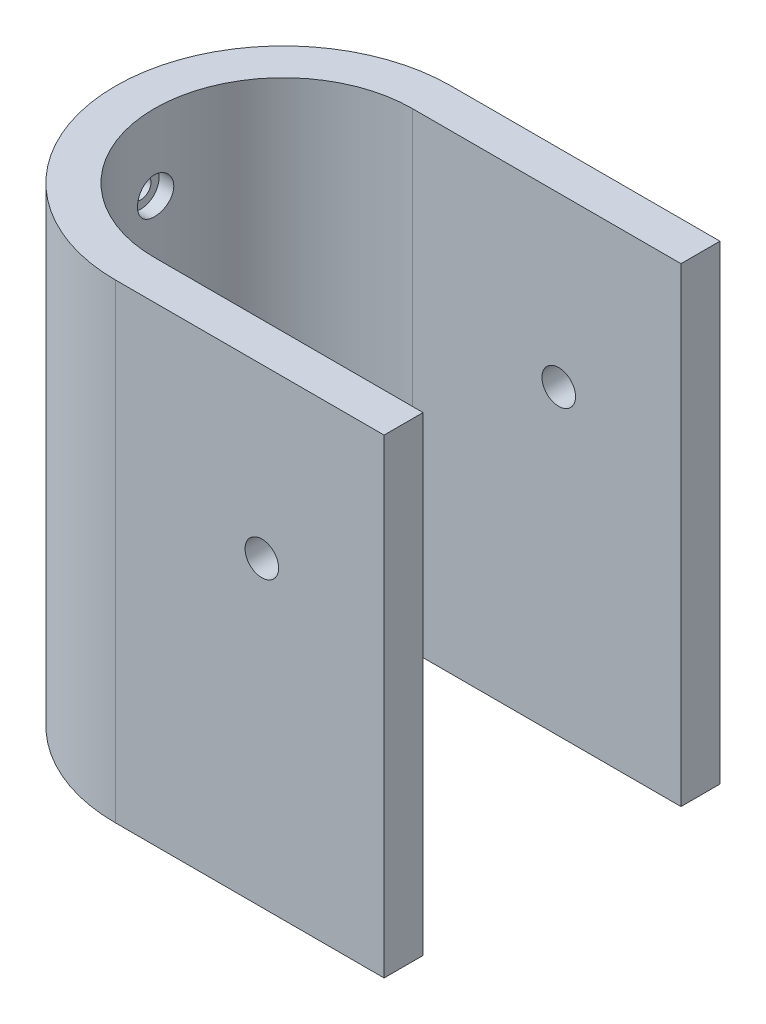
from build123d import *

# Parameters (mm, degrees)
EXTRUDE_1_DEPTH          = 70
CUT_EXTRUDE_1_DEPTH      = 3
CUT_EXTRUDE_1_DEPTH_BACK = 79.421935707
SKETCH_2_R               = 1.5
SKETCH_6_R               = 2.7
SKETCH_6_R_2             = 1.5
CUT_EXTRUDE_3_DEPTH      = 21.2
SKETCH_7_W               = 40
SKETCH_7_H               = 5.8
EXTRUDE_2_DEPTH          = 70
CUT_EXTRUDE_4_REACH      = 96.868
SKETCH_8_R               = 2.5


with BuildPart() as part:
    # 草图1 → 凸台-拉伸1 (new body)
    with BuildSketch(Plane(origin=(0, 0, 0), x_dir=(1, 0, 0), z_dir=(0, 1, 0))):
        with BuildLine():
            Line((0, 25), (0, 19.2))
            ThreePointArc((0, 19.2), (-19.2, 0), (0, -19.2))
            Line((0, -19.2), (0, -25))
            ThreePointArc((0, -25), (-25, 0), (0, 25))
        make_face()
    extrude(amount=EXTRUDE_1_DEPTH)

    # 草图2 → 切除-拉伸1 (cut, two sides: drawn at the far end of the back side and taken through both)
    with BuildSketch(Plane(origin=(0, 0, 0), x_dir=(0, 0, -1), z_dir=(1, 0, 0)).offset(-CUT_EXTRUDE_1_DEPTH_BACK)):
        with Locations(Location((0, 58.75, 0), (0, 0, 180))):
            Circle(SKETCH_2_R)
        with Locations(Location((0, 44.75, 0), (0, 0, 180))):
            Circle(SKETCH_2_R)
        with Locations(Location((0, 24, 0), (0, 0, 180))):
            Circle(SKETCH_2_R)
        with Locations(Location((0, 10, 0), (0, 0, 180))):
            Circle(SKETCH_2_R)
    extrude(amount=CUT_EXTRUDE_1_DEPTH + CUT_EXTRUDE_1_DEPTH_BACK, mode=Mode.SUBTRACT)

    # 草图6 → 切除-拉伸3 (cut)
    # profile 1 of 4: a face of its own
    with BuildSketch(Plane(origin=(0, 0, 0), x_dir=(0, 0, -1), z_dir=(1, 0, 0))):
        with Locations((0, 58.75)):
            Circle(SKETCH_6_R)
        with Locations(Location((0, 58.75, 0), (0, 0, 180))):
            Circle(SKETCH_6_R_2, mode=Mode.SUBTRACT)
    # profile 2 of 4: a face of its own
    with BuildSketch(Plane(origin=(0, 0, 0), x_dir=(0, 0, -1), z_dir=(1, 0, 0))):
        with Locations((0, 44.75)):
            Circle(SKETCH_6_R)
        with Locations(Location((0, 44.75, 0), (0, 0, 180))):
            Circle(SKETCH_6_R_2, mode=Mode.SUBTRACT)
    # profile 3 of 4: a face of its own
    with BuildSketch(Plane(origin=(0, 0, 0), x_dir=(0, 0, -1), z_dir=(1, 0, 0))):
        with Locations((0, 24)):
            Circle(SKETCH_6_R)
        with Locations(Location((0, 24, 0), (0, 0, 180))):
            Circle(SKETCH_6_R_2, mode=Mode.SUBTRACT)
    # profile 4 of 4: a face of its own
    with BuildSketch(Plane(origin=(0, 0, 0), x_dir=(0, 0, -1), z_dir=(1, 0, 0))):
        with Locations((0, 10)):
            Circle(SKETCH_6_R)
        with Locations(Location((0, 10, 0), (0, 0, 180))):
            Circle(SKETCH_6_R_2, mode=Mode.SUBTRACT)
    extrude(amount=-CUT_EXTRUDE_3_DEPTH, mode=Mode.SUBTRACT)

    # 草图7 → 凸台-拉伸2 (add)
    with BuildSketch(Plane(origin=(0, 70, 0), x_dir=(1, 0, 0), z_dir=(0, 1, 0))):
        with Locations((20, 22.1)):
            Rectangle(SKETCH_7_W, SKETCH_7_H)
        with Locations((20, -22.1)):
            Rectangle(SKETCH_7_W, SKETCH_7_H)
    extrude(amount=-EXTRUDE_2_DEPTH)

    # 切除-拉伸4: up to this face of the body (flat: up to its plane)
    cut_extrude_4_end = Plane(part.part.faces().sort_by_distance((20, 35, -25))[0])
    # 草图8 → 切除-拉伸4 (cut, up to the picked face)
    with BuildSketch(Plane.XY.offset(25), mode=Mode.PRIVATE) as cut_extrude_4_sk1:
        with Locations((21.8, 45)):
            Circle(SKETCH_8_R)
    cut_extrude_4_tool1 = split(extrude(cut_extrude_4_sk1.sketch, amount=-CUT_EXTRUDE_4_REACH, mode=Mode.PRIVATE), bisect_by=cut_extrude_4_end, keep=Keep.BOTH, mode=Mode.PRIVATE)
    add(cut_extrude_4_tool1.solids().sort_by(Axis((21.8, 45, 25), (0, 0, -1)))[0], mode=Mode.SUBTRACT)


solid = part.part
